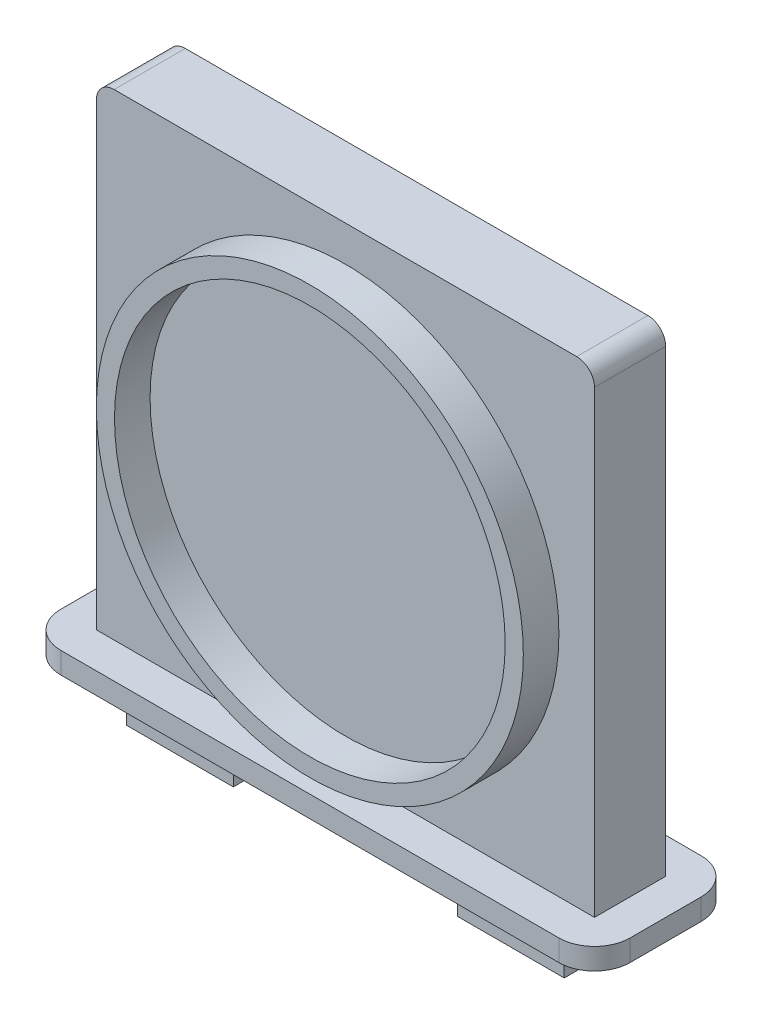
from build123d import *

# Parameters (mm, degrees)
SKETCH1_W           = 70
SKETCH1_H           = 70
BOSS_EXTRUDE1_DEPTH = 10
SKETCH2_R           = 30
SKETCH2_R_2         = 27.45
BOSS_EXTRUDE2_DEPTH = 5
FILLET1_R           = 2.5
BOSS_EXTRUDE3_DEPTH = 10
SKETCH5_R           = 1.5
SKETCH5_W           = 70
SKETCH5_H           = 10
BOSS_EXTRUDE5_DEPTH = 3


with BuildPart() as part:
    # Sketch1 → Boss-Extrude1 (new body)
    with BuildSketch(Plane.XY):
        Rectangle(SKETCH1_W, SKETCH1_H)
    extrude(amount=BOSS_EXTRUDE1_DEPTH)

    # Sketch2 → Boss-Extrude2 (add)
    with BuildSketch(Plane.XY.offset(10)):
        Circle(SKETCH2_R)
        Circle(SKETCH2_R_2, mode=Mode.SUBTRACT)
    extrude(amount=BOSS_EXTRUDE2_DEPTH)

    # Fillet1
    fillet1_edges = [part.edges().sort_by_distance(p)[0] for p in [
        (-35, 35, 5),
        (35, 35, 5),
    ]]
    fillet(fillet1_edges, radius=FILLET1_R)

    # Sketch3 → Boss-Extrude3 (add)
    with BuildSketch(Plane(origin=(0, 0, 0), x_dir=(-1, 0, 0), z_dir=(0, 0, -1))):
        Polygon((-20.75, -38.5), (-15.75, -38.5), (-15.75, -41.5), (-30.75, -41.5), (-30.75, -38.5), (-25.75, -38.5), (-25.75, -35), (-20.75, -35), align=None)
        Polygon((30.75, -38.5), (30.75, -41.5), (15.75, -41.5), (15.75, -38.5), (20.75, -38.5), (20.75, -35), (25.75, -35), (25.75, -38.5), align=None)
    extrude(amount=-BOSS_EXTRUDE3_DEPTH)

    # Sketch5 → Boss-Extrude5 (add)
    with BuildSketch(Plane.XZ.offset(35)):
        with BuildLine():
            Line((5, -5), (35, -5))
            ThreePointArc((35, -5), (38.535533906, -3.535533906), (40, 0))
            Line((40, 0), (40, 10))
            ThreePointArc((40, 10), (38.535533906, 13.535533906), (35, 15))
            Line((35, 15), (-35, 15))
            ThreePointArc((-35, 15), (-38.535533906, 13.535533906), (-40, 10))
            Line((-40, 10), (-40, 0))
            ThreePointArc((-40, 0), (-38.535533906, -3.535533906), (-35, -5))
            Line((-35, -5), (-5, -5))
            Line((-5, -5), (-5, -5.5))
            ThreePointArc((-5, -5.5), (-4.853553391, -5.853553391), (-4.5, -6))
            Line((-4.5, -6), (4.5, -6))
            ThreePointArc((4.5, -6), (4.853553391, -5.853553391), (5, -5.5))
            Line((5, -5.5), (5, -5))
        make_face()
        with Locations(Location((0, -3, 0), (0, 0, 270))):
            Circle(SKETCH5_R, mode=Mode.SUBTRACT)
        with Locations((0, 5)):
            Rectangle(SKETCH5_W, SKETCH5_H, mode=Mode.SUBTRACT)
    extrude(amount=-BOSS_EXTRUDE5_DEPTH)


solid = part.part
